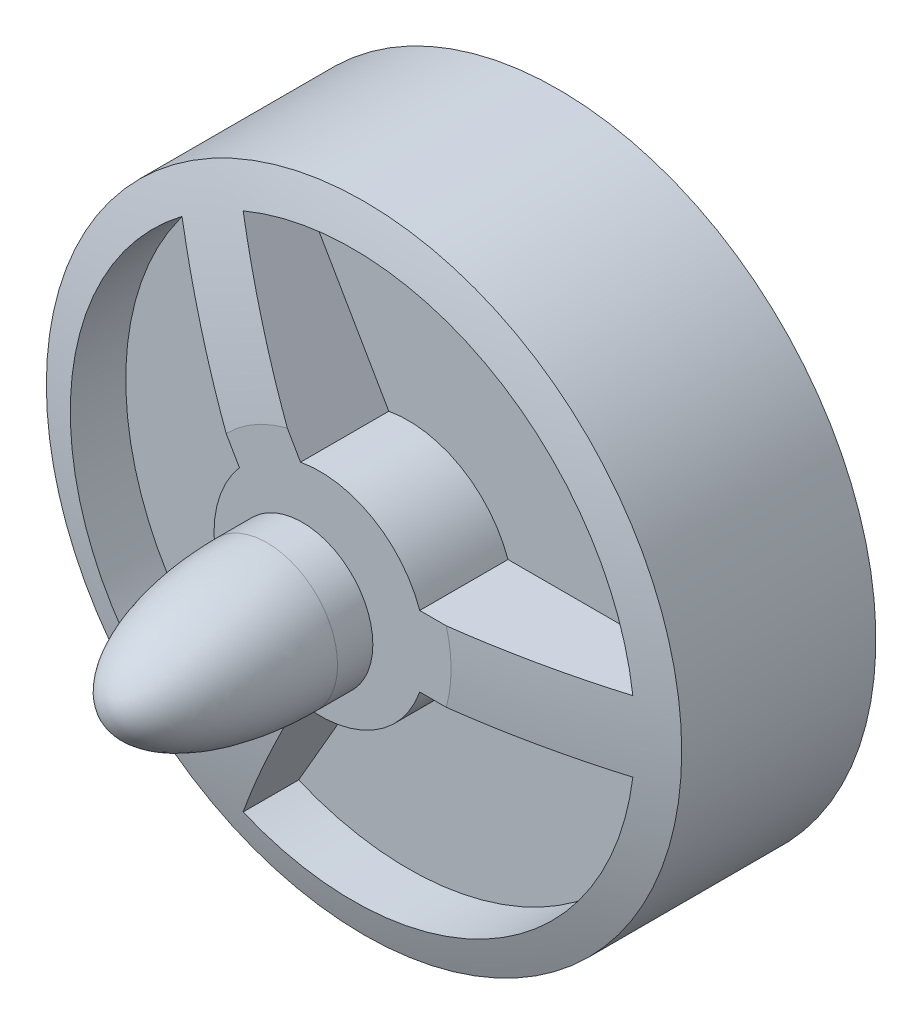
from build123d import *

# Parameters (mm, degrees)
SKETCH1_R            = 18
BOSS_EXTRUDE1_DEPTH  = 10
SKETCH5_R            = 3
BOSS_EXTRUDE4_DEPTH  = 2
BOSS_EXTRUDE9_DEPTH  = 3
CUT_EXTRUDE3_START   = -3
SKETCH12_R           = 3
SKETCH12_R_2         = 2
CUT_EXTRUDE3_DEPTH   = 3
SKETCH13_R           = 2.003734505
CUT_EXTRUDE4_DEPTH   = 0.5
SKETCH14_R           = 2
SKETCH14_R_2         = 1.5
CUT_EXTRUDE5_DEPTH   = 1
DOME4_FACE_RADIUS    = 18
DOME4_HEIGHT         = 3
SKETCH23_R           = 8
CUT_EXTRUDE16_DEPTH  = 9
CUT_EXTRUDE19_DEPTH  = 5
SKETCH26_R           = 1
BOSS_EXTRUDE10_DEPTH = 1
SKETCH27_R           = 4
BOSS_EXTRUDE12_DEPTH = 2
DOME5_FACE_RADIUS    = 4
DOME5_HEIGHT         = 9
BOSS_EXTRUDE15_DEPTH = 1
SKETCH29_R           = 18
SKETCH29_R_2         = 17.5
BOSS_EXTRUDE16_DEPTH = 1
SKETCH30_R           = 15.5
SKETCH30_R_2         = 15
BOSS_EXTRUDE17_DEPTH = 1


with BuildPart() as part:
    # Sketch1 → Boss-Extrude1 (new body)
    with BuildSketch(Plane.XY):
        Circle(SKETCH1_R)
    extrude(amount=BOSS_EXTRUDE1_DEPTH)

    # Sketch5 → Boss-Extrude4 (add)
    with BuildSketch(Plane(origin=(0, 0, 0), x_dir=(-1, 0, 0), z_dir=(0, 0, -1))):
        with Locations(Location((0, 0, 0), (0, 0, 180))):
            Circle(SKETCH5_R)
    extrude(amount=BOSS_EXTRUDE4_DEPTH)

    # Sketch6 → Boss-Extrude9 (add)
    with BuildSketch(Plane(origin=(0, 0, -2), x_dir=(-1, 0, 0), z_dir=(0, 0, -1))):
        Polygon((0, 8), (-8, 0), (0, -8), (8, 0), align=None)
        with BuildLine():
            Line((-10, 2), (10, 2))
            ThreePointArc((10, 2), (12, 0), (10, -2))
            Line((10, -2), (-10, -2))
            ThreePointArc((-10, -2), (-12, 0), (-10, 2))
        make_face()
        with BuildLine():
            Line((2, 10), (2, -10))
            ThreePointArc((2, -10), (0, -12), (-2, -10))
            Line((-2, -10), (-2, 10))
            ThreePointArc((-2, 10), (0, 12), (2, 10))
        make_face()
    extrude(amount=BOSS_EXTRUDE9_DEPTH)

    # Sketch12 → Cut-Extrude3 (cut)
    with BuildSketch(Plane(origin=(0, 0, -5), x_dir=(-1, 0, 0), z_dir=(0, 0, -1)).offset(CUT_EXTRUDE3_START)):
        with Locations(Location((0, 0, 0), (0, 0, 180))):
            Circle(SKETCH12_R)
        Circle(SKETCH12_R_2, mode=Mode.SUBTRACT)
    extrude(amount=CUT_EXTRUDE3_DEPTH, mode=Mode.SUBTRACT)


with BuildPart() as cut_extrude3_piece_1:
    # of the separate pieces the step leaves, piece 1, a body of its own (cut_extrude3_pieces)
    add(part.part.solids().sort_by_distance((3, 0, 0))[0])

    # Sketch13 → Cut-Extrude4 (cut)
    with BuildSketch(Plane(origin=(0, 0, -5), x_dir=(-1, 0, 0), z_dir=(0, 0, -1))):
        Circle(SKETCH13_R)
    extrude(amount=-CUT_EXTRUDE4_DEPTH, mode=Mode.SUBTRACT)

    # Sketch14 → Cut-Extrude5 (cut)
    with BuildSketch(Plane(origin=(0, 0, -4.5), x_dir=(-1, 0, 0), z_dir=(0, 0, -1))):
        Circle(SKETCH14_R)
        Circle(SKETCH14_R_2, mode=Mode.SUBTRACT)
    extrude(amount=-CUT_EXTRUDE5_DEPTH, mode=Mode.SUBTRACT)

    # Dome4: a dome of height H over a round flat face of radius A is a cap of a sphere of radius (A * A + H * H) / (2 * H)
    dome4_r = (DOME4_FACE_RADIUS * DOME4_FACE_RADIUS + DOME4_HEIGHT * DOME4_HEIGHT) / (2 * DOME4_HEIGHT)
    dome4_base = Plane((0, 0, 10), z_dir=(0, 0, 1))
    with Locations(dome4_base.offset(DOME4_HEIGHT - dome4_r)):
        dome4_ball = Sphere(dome4_r, mode=Mode.PRIVATE)
    add(split(dome4_ball, bisect_by=dome4_base, keep=Keep.TOP, mode=Mode.PRIVATE))

    # Sketch23 → Cut-Extrude16 (cut)
    with BuildSketch(Plane.XY.offset(12.5)):
        Circle(SKETCH23_R)
    extrude(amount=CUT_EXTRUDE16_DEPTH, mode=Mode.SUBTRACT)

    # Sketch25 → Cut-Extrude19 (cut)
    with BuildSketch(Plane.XY.offset(12.5)):
        with BuildLine():
            ThreePointArc((7.158910532, -2), (3.716517187, -6.437196595), (-1.847404458, -7.199798384))
            Line((-1.847404458, -7.199798384), (-6.205203126, -14.747727085))
            ThreePointArc((-6.205203126, -14.747727085), (8, -13.856406461), (15.874507866, -2))
            Line((15.874507866, -2), (7.158910532, -2))
        make_face()
        with BuildLine():
            ThreePointArc((5.656854249, -2), (3, -5.196152423), (-1.096376317, -5.898979486))
            Line((-1.096376317, -5.898979486), (-1.847404458, -7.199798384))
            ThreePointArc((-1.847404458, -7.199798384), (3.716517187, -6.437196595), (7.158910532, -2))
            Line((7.158910532, -2), (5.656854249, -2))
        make_face()
        with BuildLine():
            Line((-9.669304741, -12.747727085), (-5.311506073, -5.199798384))
            ThreePointArc((-5.311506073, -5.199798384), (-7.433034374, 0), (-5.311506073, 5.199798384))
            Line((-5.311506073, 5.199798384), (-9.669304741, 12.747727085))
            ThreePointArc((-9.669304741, 12.747727085), (-16, 0), (-9.669304741, -12.747727085))
        make_face()
        with BuildLine():
            Line((-5.311506073, -5.199798384), (-4.560477932, -3.898979486))
            ThreePointArc((-4.560477932, -3.898979486), (-6, 0), (-4.560477932, 3.898979486))
            Line((-4.560477932, 3.898979486), (-5.311506073, 5.199798384))
            ThreePointArc((-5.311506073, 5.199798384), (-7.433034374, 0), (-5.311506073, -5.199798384))
        make_face()
        with BuildLine():
            Line((-6.205203126, 14.747727085), (-1.847404458, 7.199798384))
            ThreePointArc((-1.847404458, 7.199798384), (3.716517187, 6.437196595), (7.158910532, 2))
            Line((7.158910532, 2), (15.874507866, 2))
            ThreePointArc((15.874507866, 2), (8, 13.856406461), (-6.205203126, 14.747727085))
        make_face()
        with BuildLine():
            Line((-1.847404458, 7.199798384), (-1.096376317, 5.898979486))
            ThreePointArc((-1.096376317, 5.898979486), (3, 5.196152423), (5.656854249, 2))
            Line((5.656854249, 2), (7.158910532, 2))
            ThreePointArc((7.158910532, 2), (3.716517187, 6.437196595), (-1.847404458, 7.199798384))
        make_face()
    extrude(amount=-CUT_EXTRUDE19_DEPTH, mode=Mode.SUBTRACT)

    # Sketch26 → Boss-Extrude10 (add)
    with BuildSketch(Plane.XY.offset(12.5)):
        Circle(SKETCH26_R)
    extrude(amount=BOSS_EXTRUDE10_DEPTH)

    # Sketch27 → Boss-Extrude12 (add)
    with BuildSketch(Plane.XY.offset(13.5)):
        Circle(SKETCH27_R)
    extrude(amount=BOSS_EXTRUDE12_DEPTH)

    # Dome5: an elliptical dome of height H over a round flat face of radius A is half a spheroid: the quarter ellipse of half axes A and H revolved about the face's axis
    with BuildSketch(Plane((0, 0, 15.5), x_dir=(0, 1, 0), z_dir=(1, 0, 0)), mode=Mode.PRIVATE) as dome5_quarter:
        Ellipse(DOME5_FACE_RADIUS, DOME5_HEIGHT)
        Rectangle(DOME5_FACE_RADIUS, DOME5_HEIGHT, align=(Align.MIN, Align.MIN), mode=Mode.INTERSECT)
    revolve(dome5_quarter.sketch, axis=Axis((0, 0, 15.5), (0, 0, 1)))

    # Sketch28 → Boss-Extrude15 (add)
    with BuildSketch(Plane(origin=(0, 0, 0), x_dir=(-1, 0, 0), z_dir=(0, 0, -1))):
        with BuildLine():
            Line((-13.022755533, -10.927389365), (-12.25671109, -10.284601755))
            ThreePointArc((-12.25671109, -10.284601755), (-13.106432709, -9.177222982), (-13.856406461, -8))
            Line((-13.856406461, -8), (-14.722431864, -8.5))
            ThreePointArc((-14.722431864, -8.5), (-13.925584753, -9.750799418), (-13.022755533, -10.927389365))
        make_face()
        with BuildLine():
            Line((-15.974774553, -5.814342437), (-15.035081933, -5.472322293))
            ThreePointArc((-15.035081933, -5.472322293), (-15.454813221, -4.141104722), (-15.756924048, -2.778370843))
            Line((-15.756924048, -2.778370843), (-16.741731801, -2.95201902))
            ThreePointArc((-16.741731801, -2.95201902), (-16.420739047, -4.399923767), (-15.974774553, -5.814342437))
        make_face()
        with BuildLine():
            Line((-17, 0), (-16, 0))
            ThreePointArc((-16, 0), (-15.939115169, 1.394491884), (-15.756924048, 2.778370843))
            Line((-15.756924048, 2.778370843), (-16.741731801, 2.95201902))
            ThreePointArc((-16.741731801, 2.95201902), (-16.935309868, 1.481647627), (-17, 0))
        make_face()
        with BuildLine():
            Line((-15.974774553, 5.814342437), (-15.035081933, 5.472322293))
            ThreePointArc((-15.035081933, 5.472322293), (-14.500924593, 6.761892188), (-13.856406461, 8))
            Line((-13.856406461, 8), (-14.722431864, 8.5))
            ThreePointArc((-14.722431864, 8.5), (-15.40723238, 7.18451045), (-15.974774553, 5.814342437))
        make_face()
        with BuildLine():
            Line((-13.022755533, 10.927389365), (-12.25671109, 10.284601755))
            ThreePointArc((-12.25671109, 10.284601755), (-11.313708499, 11.313708499), (-10.284601755, 12.25671109))
            Line((-10.284601755, 12.25671109), (-10.927389365, 13.022755533))
            ThreePointArc((-10.927389365, 13.022755533), (-12.02081528, 12.02081528), (-13.022755533, 10.927389365))
        make_face()
        with BuildLine():
            Line((-8.5, 14.722431864), (-8, 13.856406461))
            ThreePointArc((-8, 13.856406461), (-6.761892188, 14.500924593), (-5.472322293, 15.035081933))
            Line((-5.472322293, 15.035081933), (-5.814342437, 15.974774553))
            ThreePointArc((-5.814342437, 15.974774553), (-7.18451045, 15.40723238), (-8.5, 14.722431864))
        make_face()
        with BuildLine():
            ThreePointArc((-2.778370843, 15.756924048), (-1.394491884, 15.939115169), (0, 16))
            Line((0, 16), (0, 17))
            ThreePointArc((0, 17), (-1.481647627, 16.935309868), (-2.95201902, 16.741731801))
            Line((-2.95201902, 16.741731801), (-2.778370843, 15.756924048))
        make_face()
        with BuildLine():
            Line((13.022755533, -10.927389365), (12.25671109, -10.284601755))
            ThreePointArc((12.25671109, -10.284601755), (11.313708499, -11.313708499), (10.284601755, -12.25671109))
            Line((10.284601755, -12.25671109), (10.927389365, -13.022755533))
            ThreePointArc((10.927389365, -13.022755533), (12.02081528, -12.02081528), (13.022755533, -10.927389365))
        make_face()
        with BuildLine():
            Line((2.95201902, 16.741731801), (2.778370843, 15.756924048))
            ThreePointArc((2.778370843, 15.756924048), (4.141104722, 15.454813221), (5.472322293, 15.035081933))
            Line((5.472322293, 15.035081933), (5.814342437, 15.974774553))
            ThreePointArc((5.814342437, 15.974774553), (4.399923767, 16.420739047), (2.95201902, 16.741731801))
        make_face()
        with BuildLine():
            Line((8.5, 14.722431864), (8, 13.856406461))
            ThreePointArc((8, 13.856406461), (9.177222982, 13.106432709), (10.284601755, 12.25671109))
            Line((10.284601755, 12.25671109), (10.927389365, 13.022755533))
            ThreePointArc((10.927389365, 13.022755533), (9.750799418, 13.925584753), (8.5, 14.722431864))
        make_face()
        with BuildLine():
            Line((13.022755533, 10.927389365), (12.25671109, 10.284601755))
            ThreePointArc((12.25671109, 10.284601755), (13.106432709, 9.177222982), (13.856406461, 8))
            Line((13.856406461, 8), (14.722431864, 8.5))
            ThreePointArc((14.722431864, 8.5), (13.925584753, 9.750799418), (13.022755533, 10.927389365))
        make_face()
        with BuildLine():
            Line((15.974774553, 5.814342437), (15.035081933, 5.472322293))
            ThreePointArc((15.035081933, 5.472322293), (15.454813221, 4.141104722), (15.756924048, 2.778370843))
            Line((15.756924048, 2.778370843), (16.741731801, 2.95201902))
            ThreePointArc((16.741731801, 2.95201902), (16.420739047, 4.399923767), (15.974774553, 5.814342437))
        make_face()
        with BuildLine():
            Line((17, 0), (16, 0))
            ThreePointArc((16, 0), (15.939115169, -1.394491884), (15.756924048, -2.778370843))
            Line((15.756924048, -2.778370843), (16.741731801, -2.95201902))
            ThreePointArc((16.741731801, -2.95201902), (16.935309868, -1.481647627), (17, 0))
        make_face()
        with BuildLine():
            Line((15.974774553, -5.814342437), (15.035081933, -5.472322293))
            ThreePointArc((15.035081933, -5.472322293), (14.500924593, -6.761892188), (13.856406461, -8))
            Line((13.856406461, -8), (14.722431864, -8.5))
            ThreePointArc((14.722431864, -8.5), (15.40723238, -7.18451045), (15.974774553, -5.814342437))
        make_face()
        with BuildLine():
            Line((8.5, -14.722431864), (8, -13.856406461))
            ThreePointArc((8, -13.856406461), (6.761892188, -14.500924593), (5.472322293, -15.035081933))
            Line((5.472322293, -15.035081933), (5.814342437, -15.974774553))
            ThreePointArc((5.814342437, -15.974774553), (7.18451045, -15.40723238), (8.5, -14.722431864))
        make_face()
        with BuildLine():
            Line((2.95201902, -16.741731801), (2.778370843, -15.756924048))
            ThreePointArc((2.778370843, -15.756924048), (1.394491884, -15.939115169), (0, -16))
            Line((0, -16), (0, -17))
            ThreePointArc((0, -17), (1.481647627, -16.935309868), (2.95201902, -16.741731801))
        make_face()
        with BuildLine():
            Line((-2.95201902, -16.741731801), (-2.778370843, -15.756924048))
            ThreePointArc((-2.778370843, -15.756924048), (-4.141104722, -15.454813221), (-5.472322293, -15.035081933))
            Line((-5.472322293, -15.035081933), (-5.814342437, -15.974774553))
            ThreePointArc((-5.814342437, -15.974774553), (-4.399923767, -16.420739047), (-2.95201902, -16.741731801))
        make_face()
        with BuildLine():
            Line((-8.5, -14.722431864), (-8, -13.856406461))
            ThreePointArc((-8, -13.856406461), (-9.177222982, -13.106432709), (-10.284601755, -12.25671109))
            Line((-10.284601755, -12.25671109), (-10.927389365, -13.022755533))
            ThreePointArc((-10.927389365, -13.022755533), (-9.750799418, -13.925584753), (-8.5, -14.722431864))
        make_face()
    extrude(amount=BOSS_EXTRUDE15_DEPTH)

    # Sketch29 → Boss-Extrude16 (add)
    with BuildSketch(Plane(origin=(0, 0, 0), x_dir=(-1, 0, 0), z_dir=(0, 0, -1))):
        Circle(SKETCH29_R)
        Circle(SKETCH29_R_2, mode=Mode.SUBTRACT)
    extrude(amount=BOSS_EXTRUDE16_DEPTH)

    # Sketch30 → Boss-Extrude17 (add)
    with BuildSketch(Plane(origin=(0, 0, 0), x_dir=(-1, 0, 0), z_dir=(0, 0, -1))):
        with Locations(Location((0, 0, 0), (0, 0, 180))):
            Circle(SKETCH30_R)
        Circle(SKETCH30_R_2, mode=Mode.SUBTRACT)
    extrude(amount=BOSS_EXTRUDE17_DEPTH)


with BuildPart() as cut_extrude3_piece_2:
    # of the separate pieces the step leaves, piece 2, a body of its own (cut_extrude3_pieces)
    add(part.part.solids().sort_by_distance((-6, 2, -2))[0])


solid = Compound([cut_extrude3_piece_1.part, cut_extrude3_piece_2.part])
